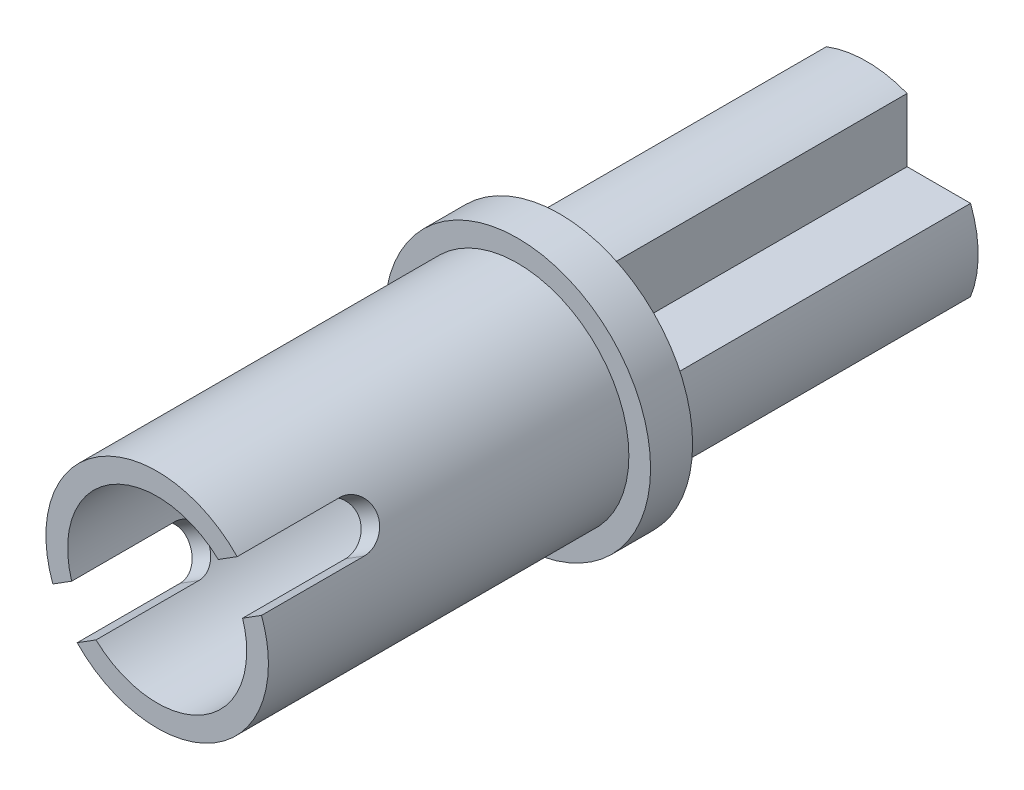
from build123d import *

# Parameters (mm, degrees)
SKETCH1_R           = 2.91
BOSS_EXTRUDE1_DEPTH = 15.53
CUT_EXTRUDE2_START  = -7.89
SKETCH2_R           = 2.91
SKETCH2_R_2         = 2.435
CUT_EXTRUDE2_DEPTH  = 7.89
SKETCH4_R           = 1.96
CUT_EXTRUDE3_DEPTH  = 7.89
CUT_EXTRUDE6_DEPTH  = 7.89
SKETCH10_R          = 2.91
SKETCH10_R_2        = 2.44
CUT_EXTRUDE10_DEPTH = 6.72


with BuildPart() as part:
    # Sketch1 → Boss-Extrude1 (new body)
    with BuildSketch(Plane.XY):
        Circle(SKETCH1_R)
    extrude(amount=BOSS_EXTRUDE1_DEPTH)

    # Sketch2 → Cut-Extrude2 (cut)
    with BuildSketch(Plane.XY.offset(15.53).offset(CUT_EXTRUDE2_START)):
        Circle(SKETCH2_R)
        Circle(SKETCH2_R_2, mode=Mode.SUBTRACT)
    extrude(amount=CUT_EXTRUDE2_DEPTH, mode=Mode.SUBTRACT)

    # Sketch4 → Cut-Extrude3 (cut)
    with BuildSketch(Plane.XY.offset(15.53)):
        Circle(SKETCH4_R)
    extrude(amount=-CUT_EXTRUDE3_DEPTH, mode=Mode.SUBTRACT)

    # Sketch6 → Cut-Extrude6 (cut)
    with BuildSketch(Plane(origin=(-2.06167752, -1.295650727, 0), x_dir=(0, 0, 1), z_dir=(-0.8466848129866222, -0.5320947542100077, 0))):
        with BuildLine():
            Line((15.53, -0.5), (13.28, -0.5))
            ThreePointArc((13.28, -0.5), (12.78, 0), (13.28, 0.5))
            Line((13.28, 0.5), (15.53, 0.5))
            ThreePointArc((15.53, 0.5), (16.03, 0), (15.53, -0.5))
        make_face()
    extrude(amount=-CUT_EXTRUDE6_DEPTH, mode=Mode.SUBTRACT)

    # Sketch10 → Cut-Extrude10 (cut)
    # profile 1 of 5: a face of its own
    with BuildSketch(Plane(origin=(0, 0, 0), x_dir=(-1, 0, 0), z_dir=(0, 0, -1))):
        Circle(SKETCH10_R)
        Circle(SKETCH10_R_2, mode=Mode.SUBTRACT)
    # profile 2 of 5: a face of its own
    with BuildSketch(Plane(origin=(0, 0, 0), x_dir=(-1, 0, 0), z_dir=(0, 0, -1))):
        with BuildLine():
            Line((-2.273845861, 0.885), (-0.885, 0.885))
            Line((-0.885, 0.885), (-0.885, 2.273845861))
            ThreePointArc((-0.885, 2.273845861), (-1.725340546, 1.725340546), (-2.273845861, 0.885))
        make_face()
    # profile 3 of 5: a face of its own
    with BuildSketch(Plane(origin=(0, 0, 0), x_dir=(-1, 0, 0), z_dir=(0, 0, -1))):
        with BuildLine():
            Line((0.885, 2.273845861), (0.885, 0.885))
            Line((0.885, 0.885), (2.273845861, 0.885))
            ThreePointArc((2.273845861, 0.885), (1.725340546, 1.725340546), (0.885, 2.273845861))
        make_face()
    # profile 4 of 5: a face of its own
    with BuildSketch(Plane(origin=(0, 0, 0), x_dir=(-1, 0, 0), z_dir=(0, 0, -1))):
        with BuildLine():
            Line((0.885, -0.885), (0.885, -2.273845861))
            ThreePointArc((0.885, -2.273845861), (1.725340546, -1.725340546), (2.273845861, -0.885))
            Line((2.273845861, -0.885), (0.885, -0.885))
        make_face()
    # profile 5 of 5: a face of its own
    with BuildSketch(Plane(origin=(0, 0, 0), x_dir=(-1, 0, 0), z_dir=(0, 0, -1))):
        with BuildLine():
            ThreePointArc((-2.273845861, -0.885), (-1.725340546, -1.725340546), (-0.885, -2.273845861))
            Line((-0.885, -2.273845861), (-0.885, -0.885))
            Line((-0.885, -0.885), (-2.273845861, -0.885))
        make_face()
    extrude(amount=-CUT_EXTRUDE10_DEPTH, mode=Mode.SUBTRACT)


solid = part.part
